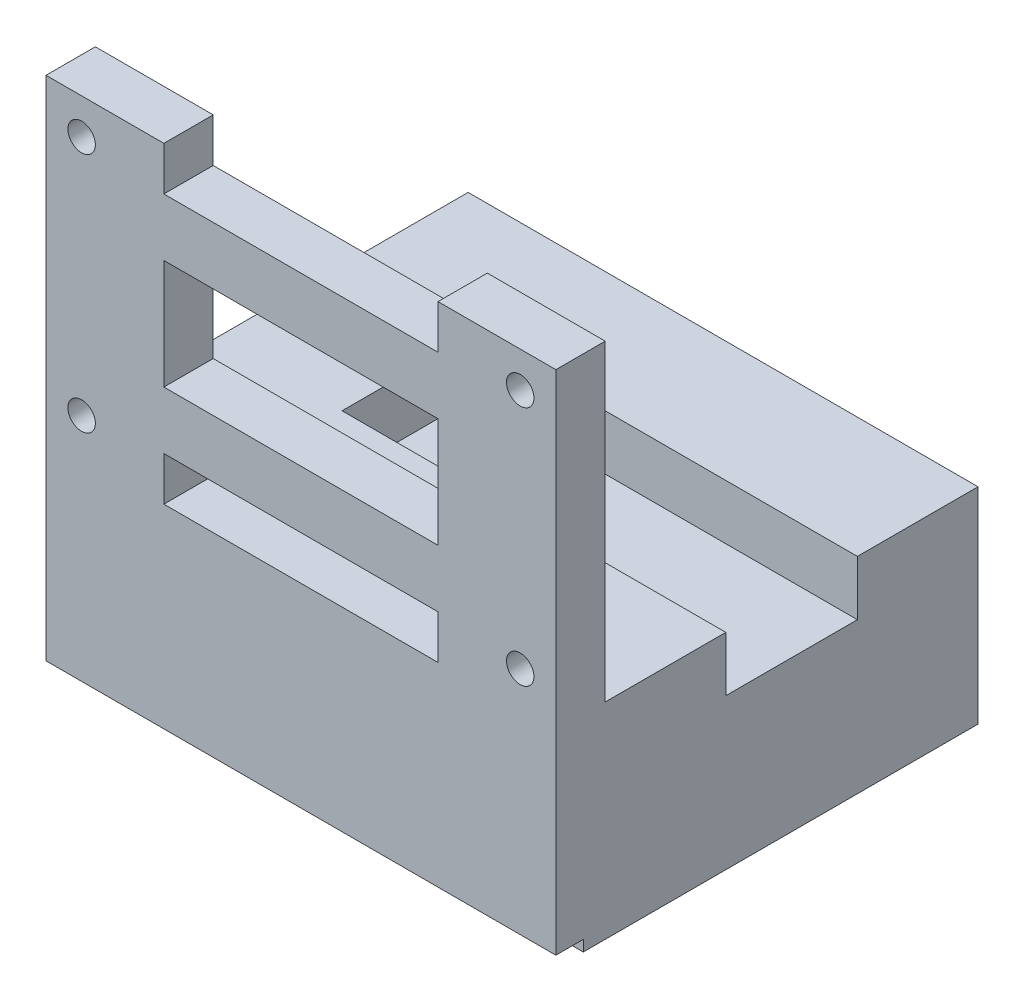
from build123d import *

# Parameters (mm, degrees)
SKETCH1_W                      = 46.5
SKETCH1_H                      = 34
BOSS_EXTRUDE1_DEPTH            = 13.75
SKETCH2_W                      = 46.5
SKETCH2_H                      = 42.25
BOSS_EXTRUDE2_DEPTH            = 2
SKETCH4_W                      = 35
SKETCH4_H                      = 12
CUT_EXTRUDE2_DEPTH             = 5
SKETCH6_W                      = 46.5
SKETCH6_H                      = 36
SKETCH6_R                      = 2
BOSS_EXTRUDE3_DEPTH            = 5
SKETCH8_W                      = 46.5
SKETCH8_H                      = 2.5
BOSS_EXTRUDE4_DEPTH            = 46.25
CUT_EXTRUDE1_REACH             = 62.18
SKETCH3_R                      = 1.25
SKETCH3_W                      = 25
SKETCH3_H                      = 10
CUT_EXTRUDE1_DIRECTION_2_DEPTH = 51
SKETCH7_W                      = 25
SKETCH7_H                      = 4
CUT_EXTRUDE3_DEPTH             = 10


with BuildPart() as part:
    # Sketch1 → Boss-Extrude1 (new body)
    with BuildSketch(Plane(origin=(0, 0, 0), x_dir=(1, 0, 0), z_dir=(0, 1, 0))):
        Rectangle(SKETCH1_W, SKETCH1_H)
    extrude(amount=BOSS_EXTRUDE1_DEPTH)

    # Sketch2 → Boss-Extrude2 (add)
    with BuildSketch(Plane.XY.offset(17)):
        with Locations((0, 21.125)):
            Rectangle(SKETCH2_W, SKETCH2_H)
    extrude(amount=BOSS_EXTRUDE2_DEPTH)

    # Sketch4 → Cut-Extrude2 (cut)
    with BuildSketch(Plane(origin=(0, 13.75, 0), x_dir=(1, 0, 0), z_dir=(0, 1, 0))):
        with Locations((5.75, 0)):
            Rectangle(SKETCH4_W, SKETCH4_H)
    extrude(amount=-CUT_EXTRUDE2_DEPTH, mode=Mode.SUBTRACT)

    # Sketch6 → Boss-Extrude3 (add)
    with BuildSketch(Plane.XZ):
        with Locations((0, 1)):
            Rectangle(SKETCH6_W, SKETCH6_H)
        with Locations(Location((16.25, -10, 0), (0, 0, 270))):
            Circle(SKETCH6_R, mode=Mode.SUBTRACT)
        with Locations(Location((-16.25, -10, 0), (0, 0, 270))):
            Circle(SKETCH6_R, mode=Mode.SUBTRACT)
        with Locations(Location((-16.25, 12, 0), (0, 0, 270))):
            Circle(SKETCH6_R, mode=Mode.SUBTRACT)
        with Locations(Location((16.25, 12, 0), (0, 0, 270))):
            Circle(SKETCH6_R, mode=Mode.SUBTRACT)
    extrude(amount=BOSS_EXTRUDE3_DEPTH)

    # Sketch8 → Boss-Extrude4 (add)
    with BuildSketch(Plane(origin=(0, -4, 0), x_dir=(-1, 0, 0), z_dir=(0, -1, 0))):
        with Locations((0, -20.25)):
            Rectangle(SKETCH8_W, SKETCH8_H)
    extrude(amount=-BOSS_EXTRUDE4_DEPTH)

    # Sketch3 → Cut-Extrude1 (cut, up to next)
    with BuildSketch(Plane.XY.offset(19), mode=Mode.PRIVATE) as cut_extrude1_sk1:
        with Locations(Location((-20, 39, 0), (0, 0, 180))):
            Circle(SKETCH3_R)
    cut_extrude1_tool1 = extrude(cut_extrude1_sk1.sketch, amount=-CUT_EXTRUDE1_REACH, mode=Mode.PRIVATE) & part.part
    # Sketch3 → Cut-Extrude1 (cut, up to next)
    with BuildSketch(Plane.XY.offset(19), mode=Mode.PRIVATE) as cut_extrude1_sk2:
        with Locations(Location((20, 39, 0), (0, 0, 180))):
            Circle(SKETCH3_R)
    cut_extrude1_tool2 = extrude(cut_extrude1_sk2.sketch, amount=-CUT_EXTRUDE1_REACH, mode=Mode.PRIVATE) & part.part
    # Sketch3 → Cut-Extrude1 (cut, up to next)
    with BuildSketch(Plane.XY.offset(19), mode=Mode.PRIVATE) as cut_extrude1_sk3:
        with Locations(Location((20, 17, 0), (0, 0, 180))):
            Circle(SKETCH3_R)
    cut_extrude1_tool3 = extrude(cut_extrude1_sk3.sketch, amount=-CUT_EXTRUDE1_REACH, mode=Mode.PRIVATE) & part.part
    # Sketch3 → Cut-Extrude1 (cut, up to next)
    with BuildSketch(Plane.XY.offset(19), mode=Mode.PRIVATE) as cut_extrude1_sk4:
        with Locations(Location((-20, 17, 0), (0, 0, 180))):
            Circle(SKETCH3_R)
    cut_extrude1_tool4 = extrude(cut_extrude1_sk4.sketch, amount=-CUT_EXTRUDE1_REACH, mode=Mode.PRIVATE) & part.part
    # Sketch3 → Cut-Extrude1 (cut, up to next)
    with BuildSketch(Plane.XY.offset(19), mode=Mode.PRIVATE) as cut_extrude1_sk5:
        with Locations((0, 28)):
            Rectangle(SKETCH3_W, SKETCH3_H)
    cut_extrude1_tool5 = extrude(cut_extrude1_sk5.sketch, amount=-CUT_EXTRUDE1_REACH, mode=Mode.PRIVATE) & part.part
    add(cut_extrude1_tool1.solids().sort_by_distance((-20, 39, 19))[0], mode=Mode.SUBTRACT)
    add(cut_extrude1_tool2.solids().sort_by_distance((20, 39, 19))[0], mode=Mode.SUBTRACT)
    add(cut_extrude1_tool3.solids().sort_by_distance((20, 17, 19))[0], mode=Mode.SUBTRACT)
    add(cut_extrude1_tool4.solids().sort_by_distance((-20, 17, 19))[0], mode=Mode.SUBTRACT)
    add(cut_extrude1_tool5.solids().sort_by_distance((0, 28, 19))[0], mode=Mode.SUBTRACT)

    # Sketch3 → Cut-Extrude1 direction 2 (cut)
    with BuildSketch(Plane.XY.offset(19)):
        with Locations(Location((-20, 39, 0), (0, 0, 180))):
            Circle(SKETCH3_R)
        with Locations(Location((20, 39, 0), (0, 0, 180))):
            Circle(SKETCH3_R)
        with Locations(Location((20, 17, 0), (0, 0, 180))):
            Circle(SKETCH3_R)
        with Locations(Location((-20, 17, 0), (0, 0, 180))):
            Circle(SKETCH3_R)
        with Locations((0, 28)):
            Rectangle(SKETCH3_W, SKETCH3_H)
    extrude(amount=CUT_EXTRUDE1_DIRECTION_2_DEPTH, mode=Mode.SUBTRACT)

    # Sketch7 → Cut-Extrude3 (cut)
    with BuildSketch(Plane(origin=(0, 0, 17), x_dir=(-1, 0, 0), z_dir=(0, 0, -1))):
        with Locations((0, 15.75)):
            Rectangle(SKETCH7_W, SKETCH7_H)
        with Locations((0, 40.25)):
            Rectangle(SKETCH7_W, SKETCH7_H)
    extrude(amount=-CUT_EXTRUDE3_DEPTH, mode=Mode.SUBTRACT)


solid = part.part
